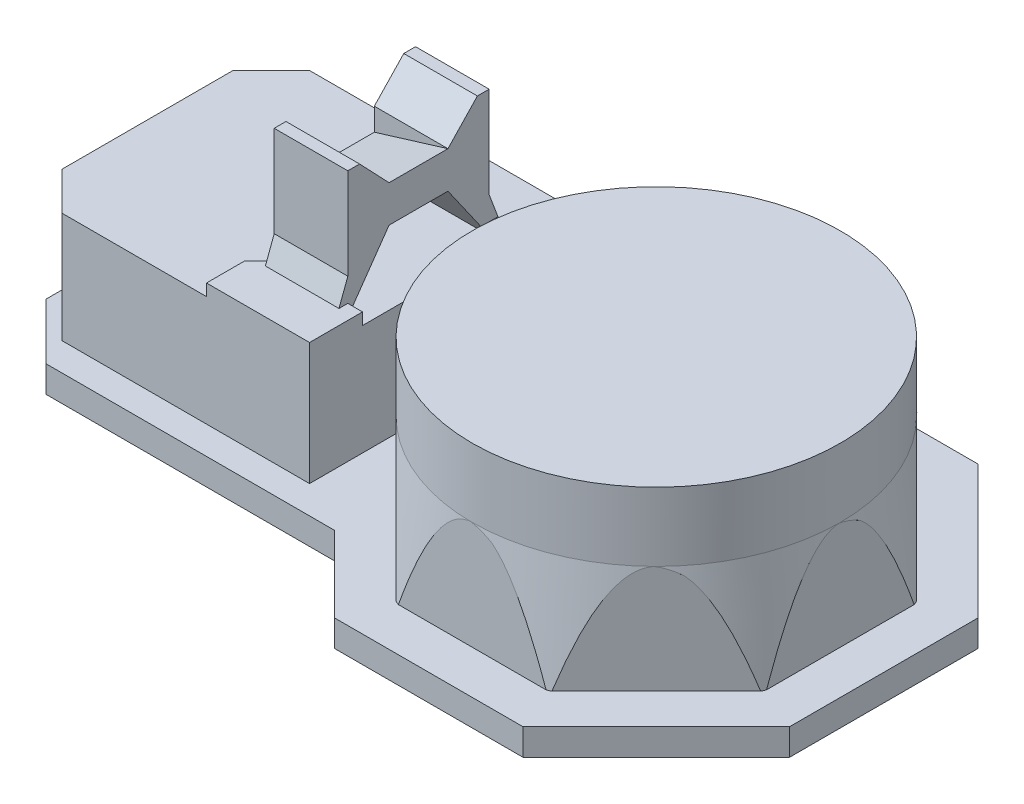
from build123d import *

# Parameters (mm, degrees)
EXTRUDE_1_DEPTH     = 9
CUT_EXTRUDE_2_DEPTH = 9
SKETCH_4_R          = 63.5
EXTRUDE_2_DEPTH     = 60
EXTRUDE_3_DEPTH     = 37.5
EXTRUDE_4_DEPTH     = 4
EXTRUDE_5_DEPTH     = 25
EXTRUDE_6_DEPTH     = 25
EXTRUDE_7_DEPTH     = 25
CUT_EXTRUDE2_START  = -60
SKETCH4_R           = 63.5
SKETCH4_R_2         = 62.5
CUT_EXTRUDE2_DEPTH  = 60
CUT_EXTRUDE4_DEPTH  = 6.8
CIRPATTERN1_COUNT   = 8
SKETCH15_W          = 73.49693164
SKETCH15_H          = 33.050154469
BOSS_EXTRUDE4_DEPTH = 16
SKETCH16_W          = 25
SKETCH16_H          = 20
BOSS_EXTRUDE5_DEPTH = 10
CUT_EXTRUDE5_DEPTH  = 20
SKETCH19_W          = 10
SKETCH19_H          = 84
CUT_EXTRUDE6_DEPTH  = 41.5


with BuildPart() as part:
    # 草图1 → 凸台-拉伸1 (new body)
    with BuildSketch(Plane(origin=(0, 0, 0), x_dir=(1, 0, 0), z_dir=(0, 1, 0))):
        Polygon((81.469684938, 32), (36.214850942, 77.254833996), (-27.785149058, 77.254833996), (-53.539983054, 51.5), (-170.539983054, 51.5), (-170.539983054, -51.5), (-53.539983054, -51.5), (-27.785149058, -77.254833996), (36.214850942, -77.254833996), (81.469684938, -32), align=None)
    extrude(amount=EXTRUDE_1_DEPTH)

    # 草图2 → 切除-拉伸2 (cut)
    with BuildSketch(Plane(origin=(0, 9, 0), x_dir=(1, 0, 0), z_dir=(0, 1, 0))):
        Polygon((-151.539983054, -51.5), (-170.539983054, -32.5), (-170.539983054, -51.5), align=None)
        Polygon((-170.539983054, 51.5), (-170.539983054, 32.5), (-151.539983054, 51.5), align=None)
    extrude(amount=-CUT_EXTRUDE_2_DEPTH, mode=Mode.SUBTRACT)

    # 草图4 → 凸台-拉伸2 (add)
    with BuildSketch(Plane(origin=(0, 9, 0), x_dir=(1, 0, 0), z_dir=(0, 1, 0))):
        with Locations(Location((4.214850942, 0, 0), (0, 0, 270))):
            Circle(SKETCH_4_R)
    extrude(amount=EXTRUDE_2_DEPTH)

    # 草图5 → 凸台-拉伸3 (add)
    with BuildSketch(Plane(origin=(0, 9, 0), x_dir=(1, 0, 0), z_dir=(0, 1, 0))):
        Polygon((-155.539983054, -42), (-61.539983054, -42), (-61.539983054, 42), (-155.539983054, 42), (-168.539983054, 29), (-168.539983054, -29), align=None)
    extrude(amount=EXTRUDE_3_DEPTH)

    # 草图7 → 凸台-拉伸4 (add)
    with BuildSketch(Plane(origin=(0, 46.5, 0), x_dir=(1, 0, 0), z_dir=(0, 1, 0))):
        Polygon((-106.539983054, 42), (-61.539983054, 42), (-61.539983054, 29), (-66.539983054, 24), (-101.539983054, 24), (-106.539983054, 29), align=None)
        Polygon((-106.539983054, -29), (-101.557170407, -24), (-66.5227957, -24), (-61.539983054, -29), (-61.539983054, -42), (-106.539983054, -42), align=None)
    extrude(amount=EXTRUDE_4_DEPTH)

    # 草图8 → 凸台-拉伸5 (add)
    with BuildSketch(Plane.ZY.offset(101.539983054)):
        Polygon((-24, 46.5), (-10, 66.5), (10, 66.5), (24, 46.5), (24, 89.5), (20, 89.5), (10, 79), (10, 75), (-10, 75), (-10, 79), (-20, 89.5), (-24, 89.5), align=None)
    extrude(amount=-EXTRUDE_5_DEPTH)

    # 草图12 → 凸台-拉伸6 (add)
    with BuildSketch(Plane.ZY.offset(101.539983054)):
        Polygon((-24, 58.5), (-27, 50.5), (-24, 50.5), align=None)
    extrude(amount=-EXTRUDE_6_DEPTH)

    # 草图15 → 凸台-拉伸7 (add)
    with BuildSketch(Plane.ZY.offset(101.539983054)):
        Polygon((24, 50.5), (27, 50.5), (24, 58.5), align=None)
    extrude(amount=-EXTRUDE_7_DEPTH)

    # Sketch4 → Cut-Extrude2 (cut)
    with BuildSketch(Plane(origin=(0, 69, 0), x_dir=(1, 0, 0), z_dir=(0, 1, 0)).offset(CUT_EXTRUDE2_START)):
        with Locations((4.214850942, 0)):
            Circle(SKETCH4_R)
        with Locations(Location((4.214850942, 0, 0), (0, 0, 270))):
            Circle(SKETCH4_R_2, mode=Mode.SUBTRACT)
    extrude(amount=CUT_EXTRUDE2_DEPTH, mode=Mode.SUBTRACT)

    # Sketch9 → Revolve2 (revolve)
    with BuildSketch(Plane.XY, mode=Mode.PRIVATE) as revolve2_sk:
        Polygon((66.714850942, 45.698851706), (71.557167148, 9), (66.714850942, 9), align=None)
    revolve(revolve2_sk.sketch.rotate(Axis((4.214850942, 69, 0), (0, 1, 0)), 167.534637939), axis=Axis((4.214850942, 69, 0), (0, 1, 0)))

    # Sketch12 → Cut-Extrude4 (cut)
    with BuildSketch(Plane.XY.offset(62.5)):
        with BuildLine():
            Line((36.214850942, 9), (-27.785149058, 9))
            add(Edge.make_bspline(
                [(-27.785149058, 9), (-0.604837494, 82.63399563), (36.214850942, 9)],
                knots=[0, 0, 0, 1, 1, 1], degree=2))
        make_face()
    cut_extrude4 = extrude(amount=CUT_EXTRUDE4_DEPTH, mode=Mode.SUBTRACT)

    # CirPattern1: Cut-Extrude4 ×8 about axis
    cirpattern1_axis = Axis((4.214850942, 69, 0), (0, 1, 0))
    for i in range(1, CIRPATTERN1_COUNT):
        add(cut_extrude4.rotate(cirpattern1_axis, i * 360 / CIRPATTERN1_COUNT), mode=Mode.SUBTRACT)

    # Sketch15 → Boss-Extrude4 (add)
    with BuildSketch(Plane(origin=(-61.539983054, 0, 0), x_dir=(0, 0, -1), z_dir=(1, 0, 0))):
        with Locations((3.027242224, 22.608056987)):
            Rectangle(SKETCH15_W, SKETCH15_H)
    extrude(amount=-BOSS_EXTRUDE4_DEPTH)

    # Sketch16 → Boss-Extrude5 (add)
    with BuildSketch(Plane(origin=(0, 75, 0), x_dir=(1, 0, 0), z_dir=(0, 1, 0))):
        with Locations((-89.039983054, 0)):
            Rectangle(SKETCH16_W, SKETCH16_H)
    extrude(amount=BOSS_EXTRUDE5_DEPTH)

    # Sketch17 → Cut-Extrude5 (cut)
    with BuildSketch(Plane.XY.offset(10)):
        Polygon((-76.539983054, 79), (-101.539983054, 71.348105906), (-101.539983054, 89.5), (-76.539983054, 89.5), align=None)
    extrude(amount=-CUT_EXTRUDE5_DEPTH, mode=Mode.SUBTRACT)

    # Sketch19 → Cut-Extrude6 (cut)
    with BuildSketch(Plane(origin=(0, 50.5, 0), x_dir=(1, 0, 0), z_dir=(0, 1, 0))):
        with Locations((-66.539983054, 0)):
            Rectangle(SKETCH19_W, SKETCH19_H)
    extrude(amount=-CUT_EXTRUDE6_DEPTH, mode=Mode.SUBTRACT)


solid = part.part
